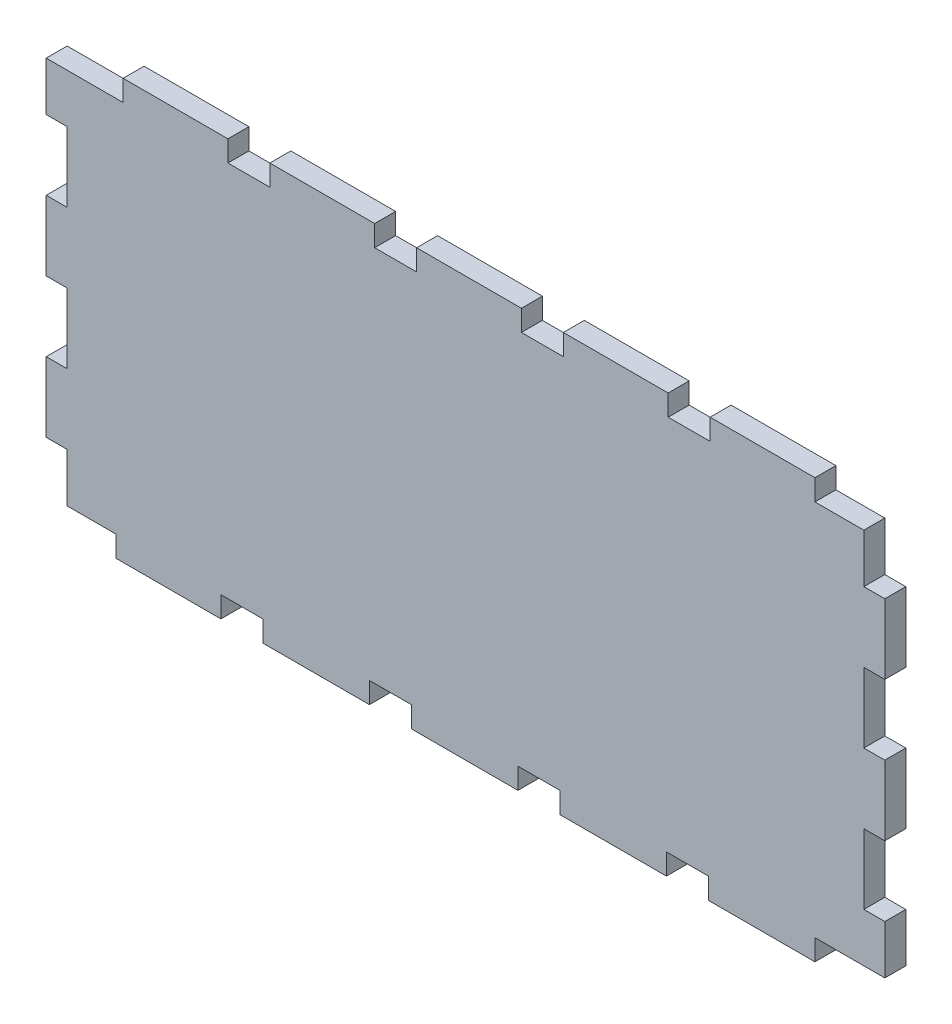
from build123d import *

# Parameters (mm, degrees)
BOSS_EXTRUDE1_DEPTH = 3


with BuildPart() as part:
    # Sketch1 → Boss-Extrude1 (new body)
    with BuildSketch(Plane.XY):
        Polygon((120, 3), (120, 10), (117, 10), (117, 20), (120, 20), (120, 30), (117, 30), (117, 40), (120, 40), (120, 50), (117, 50), (117, 57), (110, 57), (110, 60), (95, 60), (95, 57), (89, 57), (89, 60), (74, 60), (74, 57), (68, 57), (68, 60), (53, 60), (53, 57), (47, 57), (47, 60), (32, 60), (32, 57), (26, 57), (26, 60), (11, 60), (11, 57), (5, 57), (0, 57), (0, 50), (3, 50), (3, 40), (0, 40), (0, 30), (3, 30), (3, 20), (0, 20), (0, 10), (3, 10), (3, 3), (10, 3), (10, 0), (25, 0), (25, 3), (31, 3), (31, 0), (46.25, 0), (46.25, 3), (52.25, 3), (52.25, 0), (67.5, 0), (67.5, 3), (73.5, 3), (73.5, 0), (88.75, 0), (88.75, 3), (94.75, 3), (94.75, 0), (110, 0), (110, 3), (116, 3), align=None)
    extrude(amount=BOSS_EXTRUDE1_DEPTH)


solid = part.part
